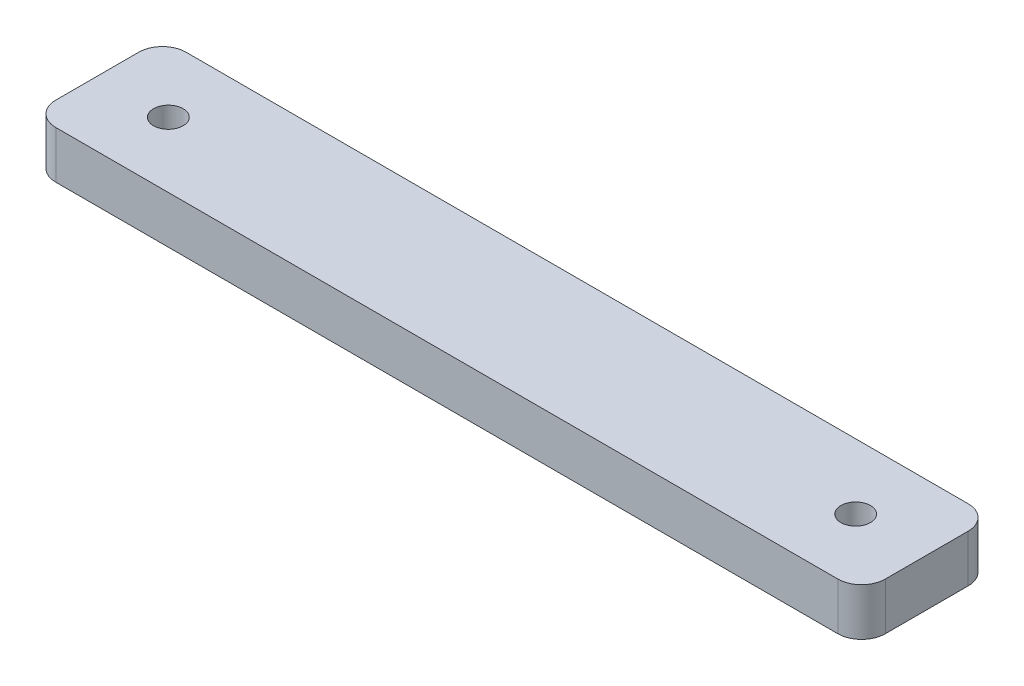
from build123d import *

# Parameters (mm, degrees)
CROQUIS1_W              = 35
CROQUIS1_H              = 5.5
CROQUIS1_R              = 0.625
SALIENTE_EXTRUIR1_DEPTH = 2
REDONDEO1_R             = 1


with BuildPart() as part:
    # Croquis1 → Saliente-Extruir1 (new body)
    with BuildSketch(Plane(origin=(0, 0, 0), x_dir=(1, 0, 0), z_dir=(0, 1, 0))):
        Rectangle(CROQUIS1_W, CROQUIS1_H)
        with Locations(Location((-14.5, 0, 0), (0, 0, 270))):
            Circle(CROQUIS1_R, mode=Mode.SUBTRACT)
        with Locations(Location((14.5, 0, 0), (0, 0, 90))):
            Circle(CROQUIS1_R, mode=Mode.SUBTRACT)
    extrude(amount=SALIENTE_EXTRUIR1_DEPTH)

    # Redondeo1
    redondeo1_edges = [part.edges().sort_by_distance(p)[0] for p in [
        (17.5, 1, 2.75),
        (-17.5, 1, 2.75),
        (-17.5, 1, -2.75),
        (17.5, 1, -2.75),
    ]]
    fillet(redondeo1_edges, radius=REDONDEO1_R)


solid = part.part
